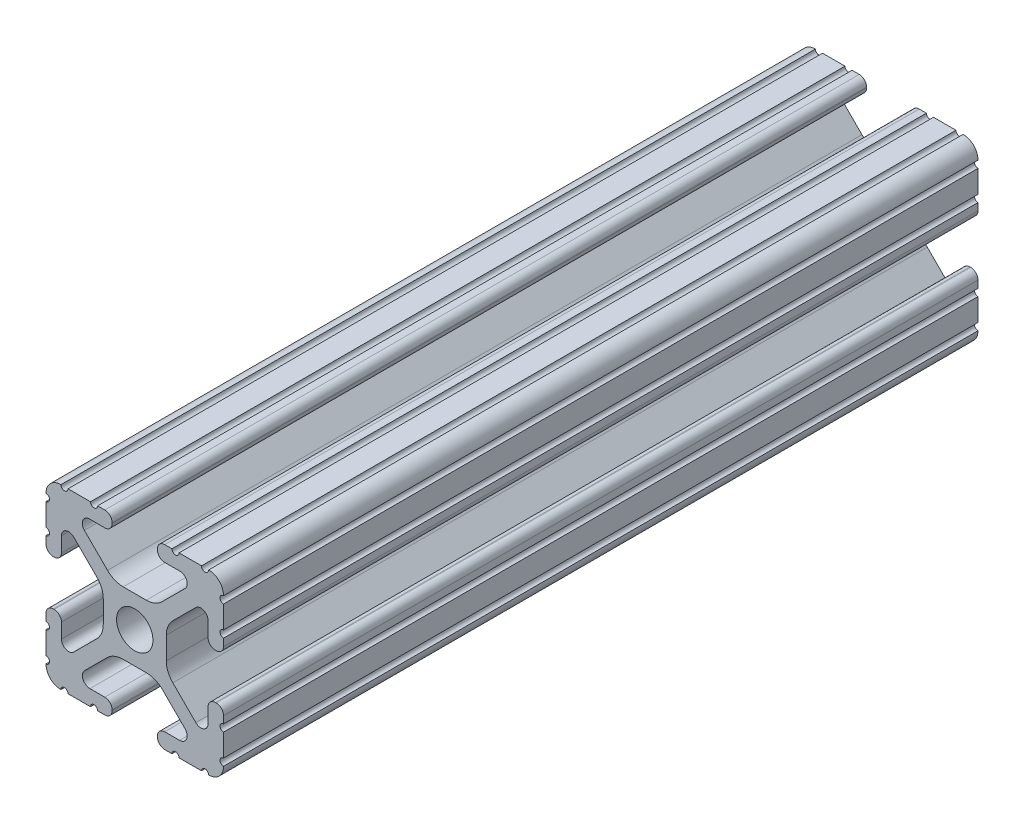
from build123d import *

# Parameters (mm, degrees)
SKETCH1_R           = 2.6035
BOSS_EXTRUDE1_DEPTH = 152.4
SKETCH2_R           = 22.79263682
CUT_EXTRUDE1_DEPTH  = 196.85


with BuildPart() as part:
    # Sketch1 → Boss-Extrude1 (new, symmetric)
    with BuildSketch(Plane.XY):
        with BuildLine():
            Line((-7.179650497, -8.645192506), (-3.952270251, -5.423690499))
            ThreePointArc((-3.952270251, -5.423690499), (-2.922936451, -4.736929036), (-1.709253557, -4.4958))
            Line((-1.709253557, -4.4958), (1.709253557, -4.4958))
            ThreePointArc((1.709253557, -4.4958), (2.922936451, -4.736929036), (3.952270251, -5.423690499))
            Line((3.952270251, -5.423690499), (7.179650497, -8.645192506))
            ThreePointArc((7.179650497, -8.645192506), (7.41473083, -9.822813117), (6.416408329, -10.4902))
            Line((6.416408329, -10.4902), (4.287512407, -10.4902))
            ThreePointArc((4.287512407, -10.4902), (3.54574862, -10.79744862), (3.2385, -11.539212407))
            Line((3.2385, -11.539212407), (3.2385, -11.650987593))
            ThreePointArc((3.2385, -11.650987593), (3.54574862, -12.39275138), (4.287512407, -12.7))
            Line((4.287512407, -12.7), (5.317126718, -12.7))
            ThreePointArc((5.317126718, -12.7), (5.825126718, -12.192), (6.333126718, -12.7))
            Line((6.333126718, -12.7), (9.550443118, -12.7))
            ThreePointArc((9.550443118, -12.7), (10.058366869, -12.192000006), (10.566443095, -12.699847501))
            ThreePointArc((10.566443095, -12.699847501), (12.082537762, -12.08250727), (12.699846982, -10.566399977))
            ThreePointArc((12.699846982, -10.566399977), (12.192000006, -10.058323491), (12.7, -9.5504))
            Line((12.7, -9.5504), (12.7, -6.3330836))
            ThreePointArc((12.7, -6.3330836), (12.192, -5.8250836), (12.7, -5.3170836))
            Line((12.7, -5.3170836), (12.7, -4.287469289))
            ThreePointArc((12.7, -4.287469289), (12.39275138, -3.545705502), (11.650987593, -3.238456882))
            Line((11.650987593, -3.238456882), (11.539212407, -3.238456882))
            ThreePointArc((11.539212407, -3.238456882), (10.79744862, -3.545705502), (10.4902, -4.287469289))
            Line((10.4902, -4.287469289), (10.4902, -6.402089023))
            ThreePointArc((10.4902, -6.402089023), (9.856505071, -7.351067942), (8.737131347, -7.129408934))
            Line((8.737131347, -7.129408934), (5.441005833, -3.840816462))
            ThreePointArc((5.441005833, -3.840816462), (4.750877967, -2.809883091), (4.5085, -1.593185507))
            Line((4.5085, -1.593185507), (4.5085, 1.593185507))
            ThreePointArc((4.5085, 1.593185507), (4.750877967, 2.809883091), (5.441005833, 3.840816462))
            Line((5.441005833, 3.840816462), (8.737131347, 7.129408934))
            ThreePointArc((8.737131347, 7.129408934), (9.856505071, 7.351067942), (10.4902, 6.402089023))
            Line((10.4902, 6.402089023), (10.4902, 4.287469289))
            ThreePointArc((10.4902, 4.287469289), (10.79744862, 3.545705502), (11.539212407, 3.238456882))
            Line((11.539212407, 3.238456882), (11.650987593, 3.238456882))
            ThreePointArc((11.650987593, 3.238456882), (12.39275138, 3.545705502), (12.7, 4.287469289))
            Line((12.7, 4.287469289), (12.7, 5.3170836))
            ThreePointArc((12.7, 5.3170836), (12.192, 5.8250836), (12.7, 6.3330836))
            Line((12.7, 6.3330836), (12.7, 9.5504))
            ThreePointArc((12.7, 9.5504), (12.192000006, 10.058323491), (12.699846982, 10.566399977))
            ThreePointArc((12.699846982, 10.566399977), (12.082537762, 12.08250727), (10.566443095, 12.699847501))
            ThreePointArc((10.566443095, 12.699847501), (10.058366869, 12.192000006), (9.550443118, 12.7))
            Line((9.550443118, 12.7), (6.333126718, 12.7))
            ThreePointArc((6.333126718, 12.7), (5.825126718, 12.192), (5.317126718, 12.7))
            Line((5.317126718, 12.7), (4.287512407, 12.7))
            ThreePointArc((4.287512407, 12.7), (3.54574862, 12.39275138), (3.2385, 11.650987593))
            Line((3.2385, 11.650987593), (3.2385, 11.539212407))
            ThreePointArc((3.2385, 11.539212407), (3.54574862, 10.79744862), (4.287512407, 10.4902))
            Line((4.287512407, 10.4902), (6.476788598, 10.4902))
            ThreePointArc((6.476788598, 10.4902), (7.432222385, 9.85140422), (7.207036008, 8.724370562))
            Line((7.207036008, 8.724370562), (3.898272566, 5.423169045))
            ThreePointArc((3.898272566, 5.423169045), (2.869120213, 4.736787962), (1.655778399, 4.4958))
            Line((1.655778399, 4.4958), (-1.655778399, 4.4958))
            ThreePointArc((-1.655778399, 4.4958), (-2.869120213, 4.736787962), (-3.898272566, 5.423169045))
            Line((-3.898272566, 5.423169045), (-7.207036008, 8.724370562))
            ThreePointArc((-7.207036008, 8.724370562), (-7.432222385, 9.85140422), (-6.476788598, 10.4902))
            Line((-6.476788598, 10.4902), (-4.287512407, 10.4902))
            ThreePointArc((-4.287512407, 10.4902), (-3.54574862, 10.79744862), (-3.2385, 11.539212407))
            Line((-3.2385, 11.539212407), (-3.2385, 11.650987593))
            ThreePointArc((-3.2385, 11.650987593), (-3.54574862, 12.39275138), (-4.287512407, 12.7))
            Line((-4.287512407, 12.7), (-5.317126718, 12.7))
            ThreePointArc((-5.317126718, 12.7), (-5.825126718, 12.192), (-6.333126718, 12.7))
            Line((-6.333126718, 12.7), (-9.550443118, 12.7))
            ThreePointArc((-9.550443118, 12.7), (-10.058366869, 12.192000006), (-10.566443095, 12.699847501))
            ThreePointArc((-10.566443095, 12.699847501), (-12.082537762, 12.08250727), (-12.699846982, 10.566399977))
            ThreePointArc((-12.699846982, 10.566399977), (-12.192000006, 10.058323491), (-12.7, 9.5504))
            Line((-12.7, 9.5504), (-12.7, 6.3330836))
            ThreePointArc((-12.7, 6.3330836), (-12.192, 5.8250836), (-12.7, 5.3170836))
            Line((-12.7, 5.3170836), (-12.7, 4.287469289))
            ThreePointArc((-12.7, 4.287469289), (-12.39275138, 3.545705502), (-11.650987593, 3.238456882))
            Line((-11.650987593, 3.238456882), (-11.539212407, 3.238456882))
            ThreePointArc((-11.539212407, 3.238456882), (-10.79744862, 3.545705502), (-10.4902, 4.287469289))
            Line((-10.4902, 4.287469289), (-10.4902, 6.402089023))
            ThreePointArc((-10.4902, 6.402089023), (-9.856505071, 7.351067942), (-8.737131347, 7.129408934))
            Line((-8.737131347, 7.129408934), (-5.441005833, 3.840816462))
            ThreePointArc((-5.441005833, 3.840816462), (-4.750877967, 2.809883091), (-4.5085, 1.593185507))
            Line((-4.5085, 1.593185507), (-4.5085, -1.593185507))
            ThreePointArc((-4.5085, -1.593185507), (-4.750877967, -2.809883091), (-5.441005833, -3.840816462))
            Line((-5.441005833, -3.840816462), (-8.737131347, -7.129408934))
            ThreePointArc((-8.737131347, -7.129408934), (-9.856505071, -7.351067942), (-10.4902, -6.402089023))
            Line((-10.4902, -6.402089023), (-10.4902, -4.287469289))
            ThreePointArc((-10.4902, -4.287469289), (-10.79744862, -3.545705502), (-11.539212407, -3.238456882))
            Line((-11.539212407, -3.238456882), (-11.650987593, -3.238456882))
            ThreePointArc((-11.650987593, -3.238456882), (-12.39275138, -3.545705502), (-12.7, -4.287469289))
            Line((-12.7, -4.287469289), (-12.7, -5.3170836))
            ThreePointArc((-12.7, -5.3170836), (-12.192, -5.8250836), (-12.7, -6.3330836))
            Line((-12.7, -6.3330836), (-12.7, -9.5504))
            ThreePointArc((-12.7, -9.5504), (-12.192000006, -10.058323491), (-12.699846982, -10.566399977))
            ThreePointArc((-12.699846982, -10.566399977), (-12.082537762, -12.08250727), (-10.566443095, -12.699847501))
            ThreePointArc((-10.566443095, -12.699847501), (-10.058366869, -12.192000006), (-9.550443118, -12.7))
            Line((-9.550443118, -12.7), (-6.333126718, -12.7))
            ThreePointArc((-6.333126718, -12.7), (-5.825126718, -12.192), (-5.317126718, -12.7))
            Line((-5.317126718, -12.7), (-4.287512407, -12.7))
            ThreePointArc((-4.287512407, -12.7), (-3.54574862, -12.39275138), (-3.2385, -11.650987593))
            Line((-3.2385, -11.650987593), (-3.2385, -11.539212407))
            ThreePointArc((-3.2385, -11.539212407), (-3.54574862, -10.79744862), (-4.287512407, -10.4902))
            Line((-4.287512407, -10.4902), (-6.416408329, -10.4902))
            ThreePointArc((-6.416408329, -10.4902), (-7.41473083, -9.822813117), (-7.179650497, -8.645192506))
        make_face()
        with Locations(Location((0, 0, 0), (0, 0, 180))):
            Circle(SKETCH1_R, mode=Mode.SUBTRACT)
    extrude(amount=BOSS_EXTRUDE1_DEPTH, both=True)

    # Sketch2 → Cut-Extrude1 (cut)
    with BuildSketch(Plane.XY.offset(152.4)):
        Circle(SKETCH2_R)
    extrude(amount=-CUT_EXTRUDE1_DEPTH, mode=Mode.SUBTRACT)


solid = part.part
